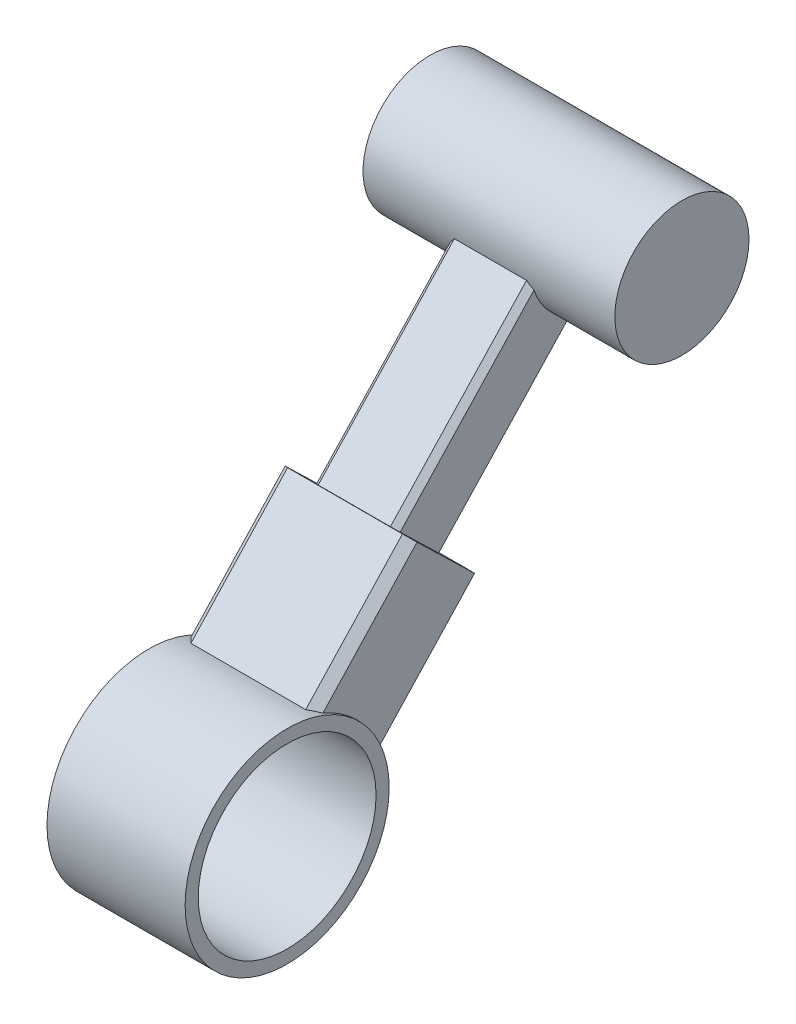
from build123d import *

# Parameters (mm, degrees)
BOSS_EXTRUDE1_DEPTH      = 12.238736
BOSS_EXTRUDE1_DEPTH_BACK = 12.238736
BOSS_EXTRUDE2_DEPTH      = 19.311112
BOSS_EXTRUDE2_DEPTH_BACK = 19.311112
BOSS_EXTRUDE3_DEPTH      = 20.236688
BOSS_EXTRUDE3_DEPTH_BACK = 20.236688
SKETCH3_R                = 29.891166833
BOSS_EXTRUDE4_DEPTH      = 36.886896
BOSS_EXTRUDE4_DEPTH_BACK = 36.886896
SKETCH4_R                = 19.656137362
SKETCH5_R                = 26.05024
CUT_EXTRUDE1_DEPTH       = 601.022741268
CHAMFER1_SIZE            = 1.66497
CHAMFER2_SIZE            = 2.486914


with BuildPart() as part:
    # Sketch1 → Boss-Extrude1 (new, two sides: drawn at the far end of the back side and taken through both)
    with BuildSketch(Plane(origin=(0, 0, 0), x_dir=(0, 0, -1), z_dir=(1, 0, 0)).offset(-BOSS_EXTRUDE1_DEPTH_BACK)):
        Polygon((177.038508, 548.169846), (190.081662, 534.280364), (128.192022, 468.216234), (114.7191, 481.689156), align=None)
    extrude(amount=BOSS_EXTRUDE1_DEPTH + BOSS_EXTRUDE1_DEPTH_BACK)

    # Sketch2 → Boss-Extrude2 (add, two sides: drawn at the far end of the back side and taken through both)
    with BuildSketch(Plane(origin=(0, 0, 0), x_dir=(0, 0, -1), z_dir=(1, 0, 0)).offset(-BOSS_EXTRUDE2_DEPTH_BACK)):
        Polygon((123.984766, 497.124482), (144.41805, 477.32315), (97.590864, 427.107096), (77.789786, 447.540126), align=None)
    extrude(amount=BOSS_EXTRUDE2_DEPTH + BOSS_EXTRUDE2_DEPTH_BACK)

    # Sketch3 → Boss-Extrude3 (add, two sides: drawn at the far end of the back side and taken through both)
    with BuildSketch(Plane(origin=(0, 0, 0), x_dir=(0, 0, -1), z_dir=(1, 0, 0)).offset(-BOSS_EXTRUDE3_DEPTH_BACK)):
        with Locations((86.798404, 438.166256)):
            Circle(SKETCH3_R)
    extrude(amount=BOSS_EXTRUDE3_DEPTH + BOSS_EXTRUDE3_DEPTH_BACK)

    # Sketch4 → Boss-Extrude4 (add, two sides: drawn at the far end of the back side and taken through both)
    with BuildSketch(Plane(origin=(0, 0, 0), x_dir=(0, 0, -1), z_dir=(1, 0, 0)).offset(-BOSS_EXTRUDE4_DEPTH_BACK)):
        with Locations((185.811668, 541.18891)):
            Circle(SKETCH4_R)
    extrude(amount=BOSS_EXTRUDE4_DEPTH + BOSS_EXTRUDE4_DEPTH_BACK)

    # Sketch5 → Cut-Extrude1 (cut, through all)
    with BuildSketch(Plane(origin=(20.236688, 0, 0), x_dir=(0, 0, -1), z_dir=(1, 0, 0))):
        with Locations((86.798404, 438.166256)):
            Circle(SKETCH5_R)
    extrude(amount=-CUT_EXTRUDE1_DEPTH, mode=Mode.SUBTRACT)

    # Chamfer1
    chamfer1_edges = [part.edges().sort_by_distance(p)[0] for p in [
        (-12.238736, 501.953153429, -159.79715777),
        (-12.238736, 515.758092022, -146.655530324),
        (12.238736, 501.953153429, -159.79715777),
        (12.238736, 515.758092022, -146.655530324),
    ]]
    chamfer(chamfer1_edges, length=CHAMFER1_SIZE)

    # Chamfer2
    chamfer2_edges = [part.edges().sort_by_distance(p)[0] for p in [
        (-19.311112, 461.841632324, -129.981314135),
        (19.311112, 461.841632324, -129.981314135),
        (-19.311112, 481.919947716, -109.819549109),
        (19.311112, 481.919947716, -109.819549109),
    ]]
    chamfer(chamfer2_edges, length=CHAMFER2_SIZE)


solid = part.part
